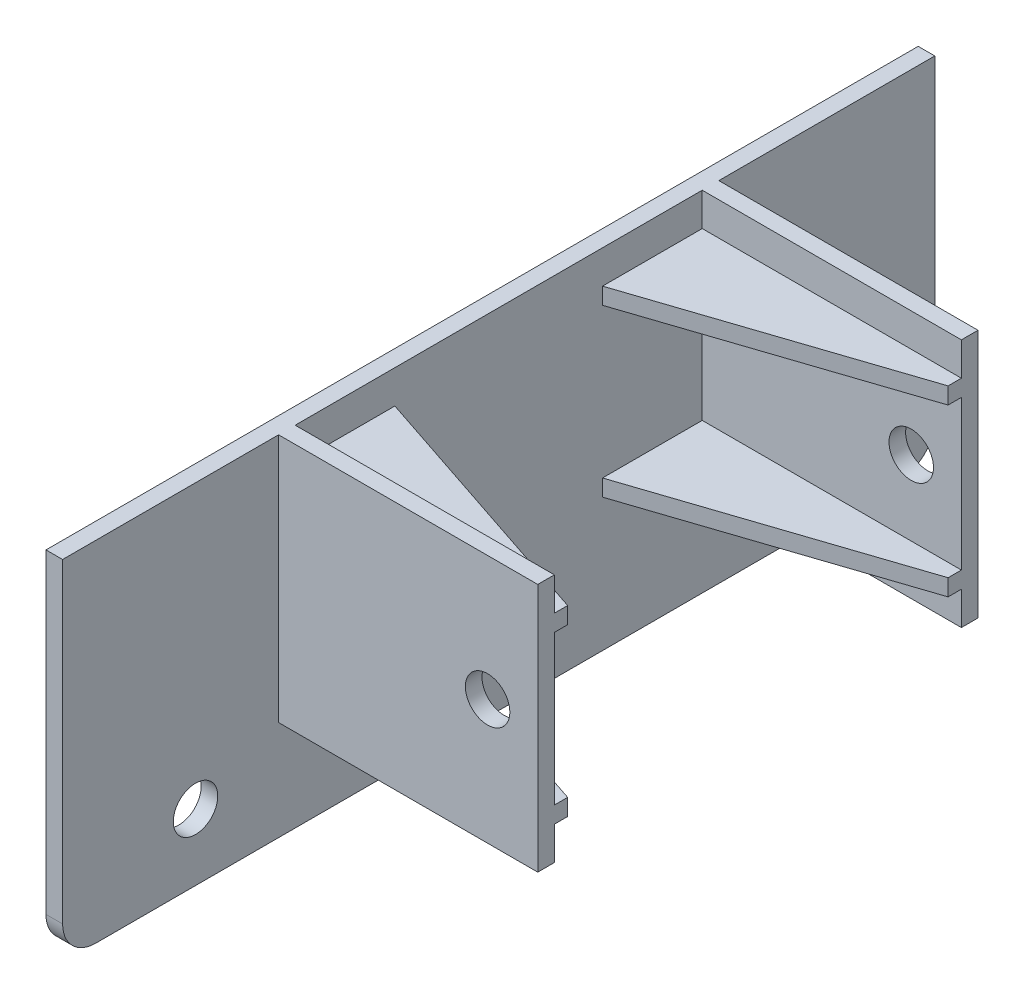
from build123d import *

# Parameters (mm, degrees)
BOSS_EXTRUDE1_DEPTH = 66.675
SKETCH3_R           = 1.7
CUT_EXTRUDE1_DEPTH  = 77.603742892
SKETCH6_R           = 1.7
CUT_EXTRUDE2_DEPTH  = 77.170890273
FILLET1_R           = 2.54
SKETCH8_W           = 22.86
SKETCH8_H           = 1.27
BOSS_EXTRUDE2_DEPTH = 17.78
CUT_EXTRUDE5_DEPTH  = 17.78
SKETCH13_W          = 7.62
SKETCH13_H          = 1.27
BOSS_EXTRUDE3_DEPTH = 22.86
CUT_EXTRUDE6_DEPTH  = 22.86
SKETCH15_R          = 1.7
CUT_EXTRUDE7_DEPTH  = 43.18
SKETCH16_W          = 3.048
SKETCH16_H          = 33.655
CUT_EXTRUDE8_DEPTH  = 43.18


with BuildPart() as part:
    # Sketch2 → Boss-Extrude1 (new body)
    with BuildSketch(Plane.XY):
        Polygon((0, 0), (-1.27, 0), (-1.27, 26.67), (25.4, 26.67), (25.4, 25.4), (0, 25.4), align=None)
    extrude(amount=BOSS_EXTRUDE1_DEPTH)

    # Sketch3 → Cut-Extrude1 (cut, through all)
    with BuildSketch(Plane.ZY.offset(1.27)):
        with Locations(Location((10.16, 5.08, 0), (0, 0, 270))):
            Circle(SKETCH3_R)
        with Locations((56.515, 5.08)):
            Circle(SKETCH3_R)
    extrude(amount=-CUT_EXTRUDE1_DEPTH, mode=Mode.SUBTRACT)

    # Sketch6 → Cut-Extrude2 (cut, through all)
    with BuildSketch(Plane(origin=(0, 26.67, 0), x_dir=(1, 0, 0), z_dir=(0, 1, 0))):
        with Locations(Location((20.32, -10.16, 0), (0, 0, 270))):
            Circle(SKETCH6_R)
        with Locations(Location((20.32, -56.515, 0), (0, 0, 270))):
            Circle(SKETCH6_R)
    extrude(amount=-CUT_EXTRUDE2_DEPTH, mode=Mode.SUBTRACT)

    # Fillet1
    fillet1_edges = [part.edges().sort_by_distance(p)[0] for p in [
        (25.4, 26.035, 66.675),
        (-0.635, 0, 66.675),
        (25.4, 26.035, 0),
        (-0.635, 0, 0),
    ]]
    fillet(fillet1_edges, radius=FILLET1_R)

    # Sketch8 → Boss-Extrude2 (add)
    with BuildSketch(Plane.XZ.offset(-25.4)):
        with Locations((11.43, 49.53)):
            Rectangle(SKETCH8_W, SKETCH8_H)
        with Locations((11.43, 17.145)):
            Rectangle(SKETCH8_W, SKETCH8_H)
    extrude(amount=BOSS_EXTRUDE2_DEPTH)

    # Sketch12 → Cut-Extrude5 (cut)
    with BuildSketch(Plane.XZ.offset(-25.4)):
        Polygon((0, 50.165), (22.86, 50.165), (22.86, 48.895), (0, 48.895), (0, 17.78), (22.86, 17.78), (22.86, 16.51), (0, 16.51), (0, 0), (31.875752577, 0), (31.875752577, 66.675), (0, 66.675), align=None)
    extrude(amount=-CUT_EXTRUDE5_DEPTH, mode=Mode.SUBTRACT)

    # Sketch13 → Boss-Extrude3 (add)
    with BuildSketch(Plane(origin=(0, 0, 0), x_dir=(0, 0, -1), z_dir=(1, 0, 0))):
        with Locations((-45.085, 10.795)):
            Rectangle(SKETCH13_W, SKETCH13_H)
        with Locations((-21.59, 10.795)):
            Rectangle(SKETCH13_W, SKETCH13_H)
        with Locations((-21.59, 23.495)):
            Rectangle(SKETCH13_W, SKETCH13_H)
        with Locations((-45.085, 23.495)):
            Rectangle(SKETCH13_W, SKETCH13_H)
    extrude(amount=BOSS_EXTRUDE3_DEPTH)

    # Sketch14 → Cut-Extrude6 (cut)
    with BuildSketch(Plane.XZ.offset(-10.16)):
        Polygon((0, 41.275), (22.86, 41.275), (22.86, 48.895), align=None)
        Polygon((22.86, 25.4), (22.86, 17.78), (0, 25.4), align=None)
    extrude(amount=-CUT_EXTRUDE6_DEPTH, mode=Mode.SUBTRACT)

    # Sketch15 → Cut-Extrude7 (cut)
    with BuildSketch(Plane.XY.offset(50.165)):
        with Locations((15.978351822, 17.145)):
            Circle(SKETCH15_R)
    extrude(amount=-CUT_EXTRUDE7_DEPTH, mode=Mode.SUBTRACT)

    # Sketch16 → Cut-Extrude8 (cut)
    with BuildSketch(Plane(origin=(0, 26.67, 0), x_dir=(1, 0, 0), z_dir=(0, 1, 0))):
        with Locations((21.336, -33.3375)):
            Rectangle(SKETCH16_W, SKETCH16_H)
    extrude(amount=-CUT_EXTRUDE8_DEPTH, mode=Mode.SUBTRACT)


solid = part.part
